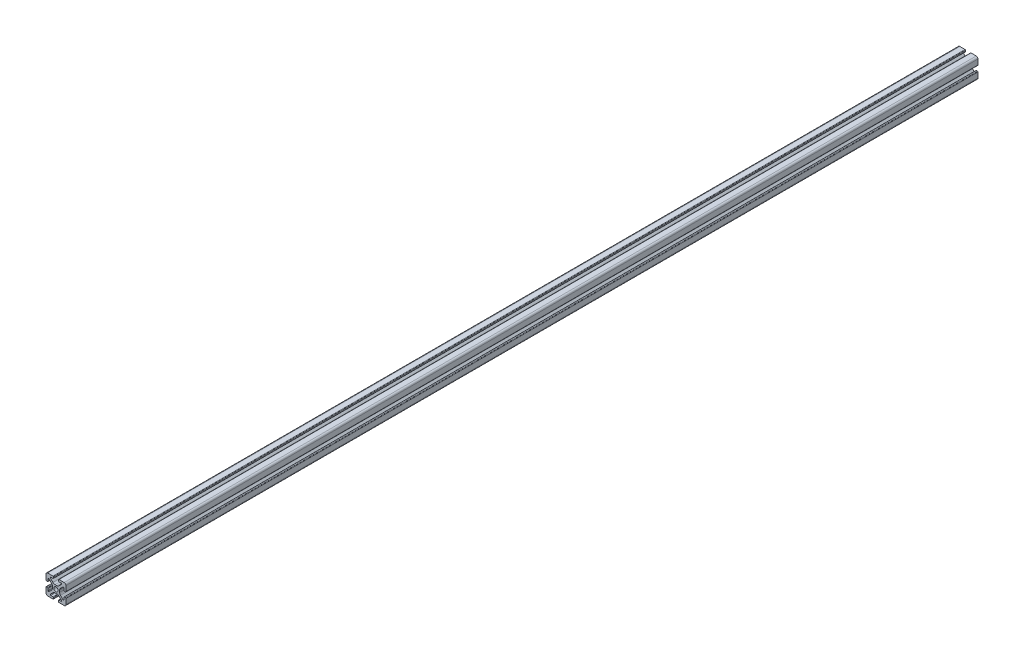
from build123d import *

# Parameters (mm, degrees)
BOSS_EXTRUDE1_DEPTH = 457.2


with BuildPart() as part:
    # Sketch4 → Boss-Extrude1 (new, symmetric)
    with BuildSketch(Plane.XY):
        with BuildLine():
            Line((3, -10), (8.25, -10))
            ThreePointArc((8.25, -10), (9.487436867, -9.487436867), (10, -8.25))
            Line((10, -8.25), (10, -3))
            ThreePointArc((10, -3), (9.853553391, -2.646446609), (9.5, -2.5))
            Line((9.5, -2.5), (8.424621202, -2.5))
            ThreePointArc((8.424621202, -2.5), (8.071067812, -2.646446609), (7.924621202, -3))
            Line((7.924621202, -3), (7.924621202, -5.25))
            ThreePointArc((7.924621202, -5.25), (7.615962919, -5.711939766), (7.071067812, -5.603553391))
            Line((7.071067812, -5.603553391), (4.478679656, -3.011165235))
            ThreePointArc((4.478679656, -3.011165235), (3.828361402, -2.037895189), (3.6, -0.889844892))
            Line((3.6, -0.889844892), (3.6, 0))
            Line((3.6, 0), (2.15, 0))
            ThreePointArc((2.15, 0), (1.52027958, -1.52027958), (0, -2.15))
            Line((0, -2.15), (0, -3.6))
            Line((0, -3.6), (0.889844892, -3.6))
            ThreePointArc((0.889844892, -3.6), (2.037895189, -3.828361402), (3.011165235, -4.478679656))
            Line((3.011165235, -4.478679656), (5.603553391, -7.071067812))
            ThreePointArc((5.603553391, -7.071067812), (5.711939766, -7.615962919), (5.25, -7.924621202))
            Line((5.25, -7.924621202), (3, -7.924621202))
            ThreePointArc((3, -7.924621202), (2.646446609, -8.071067812), (2.5, -8.424621202))
            Line((2.5, -8.424621202), (2.5, -9.5))
            ThreePointArc((2.5, -9.5), (2.646446609, -9.853553391), (3, -10))
        make_face()
    extrude(amount=BOSS_EXTRUDE1_DEPTH, both=True)

    # Mirror1: part across plane


with BuildPart() as part_1:
    add(part.part)
    add(part.part.mirror(Plane(origin=(0, 0, 0), x_dir=(0, 0, 1), z_dir=(1, 0, 0))))

    # Mirror2: part across plane


with BuildPart() as part_2:
    add(part_1.part)
    add(part_1.part.mirror(Plane.ZX))


solid = part_2.part
